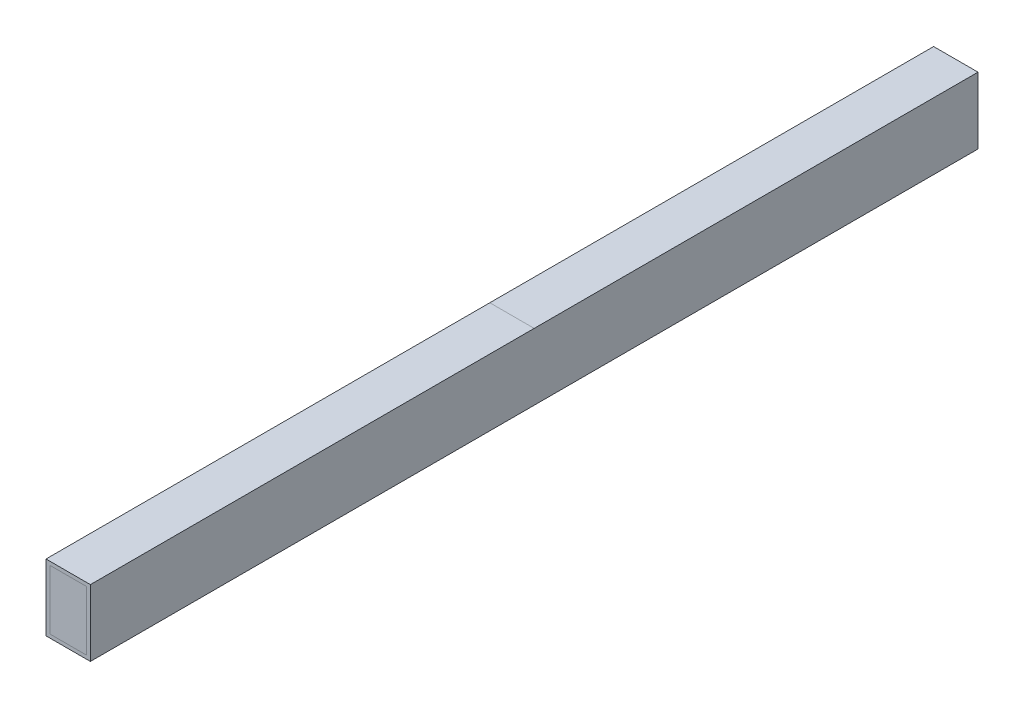
from build123d import *

# Parameters (mm, degrees)
SZKIC1_W                    = 10
SZKIC1_H                    = 15
DODANIE_WYCI_GNI_CIE3_DEPTH = 200
PODZIEL1_SURFACE_1_BACK     = 201.811
PODZIEL1_SURFACE_1_DEPTH    = 403.622
PODZIEL1_SURFACE_2_BACK     = 201.811
PODZIEL1_SURFACE_2_DEPTH    = 403.622


with BuildPart() as part:
    # Szkic1 → Dodanie-wyciągnięcie3 (new body)
    with BuildSketch(Plane.XY):
        with Locations((5, -7.5)):
            Rectangle(SZKIC1_W, SZKIC1_H)
    extrude(amount=DODANIE_WYCI_GNI_CIE3_DEPTH)


with BuildPart() as body_2:
    # Podziel1: the piece behind the surface
    add(part.part)
    # Podziel1 surface: a surface, the sketch's curves swept straight by 403.622 mm
    with BuildLine(Plane.XY.offset(200).offset(-PODZIEL1_SURFACE_1_BACK), mode=Mode.PRIVATE) as podziel1_surface_1_path:
        Line((0.9, -0.8), (9.1, -0.8))
        Line((9.1, -0.8), (9.1, -14.2))
        Line((9.1, -14.2), (0.9, -14.2))
        Line((0.9, -14.2), (0.9, -0.8))
    podziel1_surface_1 = Shell.extrude(podziel1_surface_1_path.wire(), (0 * PODZIEL1_SURFACE_1_DEPTH, 0 * PODZIEL1_SURFACE_1_DEPTH, 1 * PODZIEL1_SURFACE_1_DEPTH))
    split(bisect_by=podziel1_surface_1, keep=Keep.BOTTOM)


with BuildPart() as part_1:
    add(part.part)

    # Podziel1: split by a surface, the side it looks to stays
    # Podziel1 surface: a surface, the sketch's curves swept straight by 403.622 mm
    with BuildLine(Plane.XY.offset(200).offset(-PODZIEL1_SURFACE_2_BACK), mode=Mode.PRIVATE) as podziel1_surface_2_path:
        Line((0.9, -0.8), (9.1, -0.8))
        Line((9.1, -0.8), (9.1, -14.2))
        Line((9.1, -14.2), (0.9, -14.2))
        Line((0.9, -14.2), (0.9, -0.8))
    podziel1_surface_2 = Shell.extrude(podziel1_surface_2_path.wire(), (0 * PODZIEL1_SURFACE_2_DEPTH, 0 * PODZIEL1_SURFACE_2_DEPTH, 1 * PODZIEL1_SURFACE_2_DEPTH))
    split(bisect_by=podziel1_surface_2, keep=Keep.TOP)


solid = Compound([body_2.part, part_1.part])
